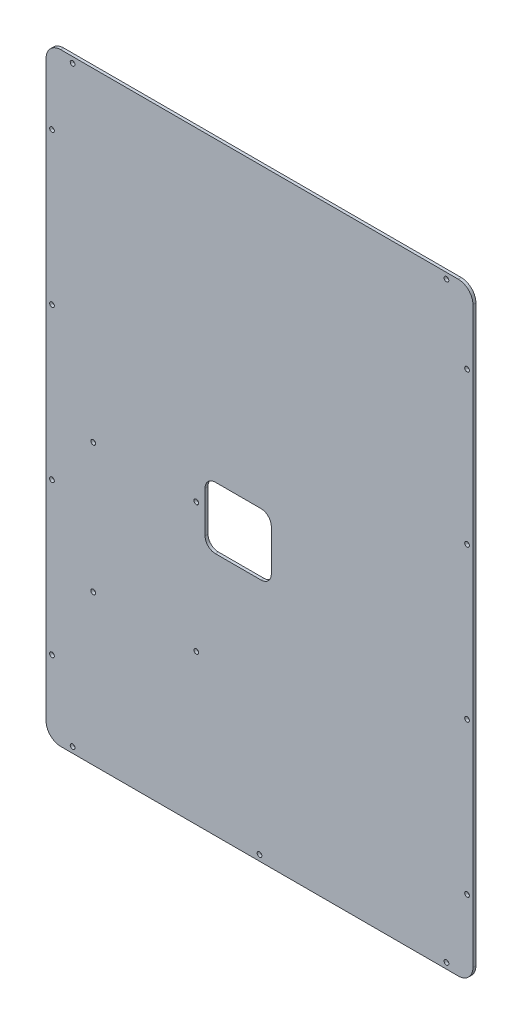
from build123d import *

# Parameters (mm, degrees)
EXTRUDE_1_DEPTH     = 2
SKETCH_2_R          = 1.6
CUT_EXTRUDE_1_DEPTH = 340.897900211
SKETCH_3_R          = 1.6
CUT_EXTRUDE_2_DEPTH = 340.897900211


with BuildPart() as part:
    # 草图1 → 凸台-拉伸1 (new body)
    with BuildSketch(Plane.XY):
        with BuildLine():
            Line((-58.97100696, 258.210702341), (211.02899304, 258.210702341))
            ThreePointArc((211.02899304, 258.210702341), (218.100060852, 255.281770153), (221.02899304, 248.210702341))
            Line((221.02899304, 248.210702341), (221.02899304, -141.789297659))
            ThreePointArc((221.02899304, -141.789297659), (218.100060852, -148.860365471), (211.02899304, -151.789297659))
            Line((211.02899304, -151.789297659), (-58.97100696, -151.789297659))
            ThreePointArc((-58.97100696, -151.789297659), (-66.042074772, -148.860365471), (-68.97100696, -141.789297659))
            Line((-68.97100696, -141.789297659), (-68.97100696, 248.210702341))
            ThreePointArc((-68.97100696, 248.210702341), (-66.042074772, 255.281770153), (-58.97100696, 258.210702341))
        make_face()
    extrude(amount=EXTRUDE_1_DEPTH)

    # 草图2 → 切除-拉伸1 (cut, through all)
    with BuildSketch(Plane.XY.offset(2)):
        with Locations((-64.97100696, 208.210702341)):
            Circle(SKETCH_2_R)
        with Locations((-64.97100696, 105.210702341)):
            Circle(SKETCH_2_R)
        with Locations((-64.97100696, 2.210702341)):
            Circle(SKETCH_2_R)
        with Locations((-64.97100696, -100.789297659)):
            Circle(SKETCH_2_R)
        with Locations((217.02899304, 208.210702341)):
            Circle(SKETCH_2_R)
        with Locations((217.02899304, 105.210702341)):
            Circle(SKETCH_2_R)
        with Locations((217.02899304, 2.210702341)):
            Circle(SKETCH_2_R)
        with Locations((217.02899304, -100.789297659)):
            Circle(SKETCH_2_R)
        with Locations((-50.97100696, 254.210702341)):
            Circle(SKETCH_2_R)
        with Locations((203.02899304, 254.210702341)):
            Circle(SKETCH_2_R)
        with Locations((-50.97100696, -147.789297659)):
            Circle(SKETCH_2_R)
        with Locations((76.02899304, -147.789297659)):
            Circle(SKETCH_2_R)
        with Locations((203.02899304, -147.789297659)):
            Circle(SKETCH_2_R)
    extrude(amount=-CUT_EXTRUDE_1_DEPTH, mode=Mode.SUBTRACT)

    # 草图3 → 切除-拉伸2 (cut, through all)
    with BuildSketch(Plane.XY.offset(2)):
        with Locations((33.02899304, 38.210702341)):
            Circle(SKETCH_3_R)
        with Locations((33.02899304, -49.789297659)):
            Circle(SKETCH_3_R)
        with Locations((-36.97100696, -49.789297659)):
            Circle(SKETCH_3_R)
        with Locations((-36.97100696, 38.210702341)):
            Circle(SKETCH_3_R)
        with BuildLine():
            Line((46.02899304, 56.210702341), (77.02899304, 56.210702341))
            ThreePointArc((77.02899304, 56.210702341), (81.978740508, 54.160449809), (84.02899304, 49.210702341))
            Line((84.02899304, 49.210702341), (84.02899304, 21.210702341))
            ThreePointArc((84.02899304, 21.210702341), (81.978740508, 16.260954873), (77.02899304, 14.210702341))
            Line((77.02899304, 14.210702341), (46.02899304, 14.210702341))
            ThreePointArc((46.02899304, 14.210702341), (41.079245572, 16.260954873), (39.02899304, 21.210702341))
            Line((39.02899304, 21.210702341), (39.02899304, 49.210702341))
            ThreePointArc((39.02899304, 49.210702341), (41.079245572, 54.160449809), (46.02899304, 56.210702341))
        make_face()
    extrude(amount=-CUT_EXTRUDE_2_DEPTH, mode=Mode.SUBTRACT)


solid = part.part
